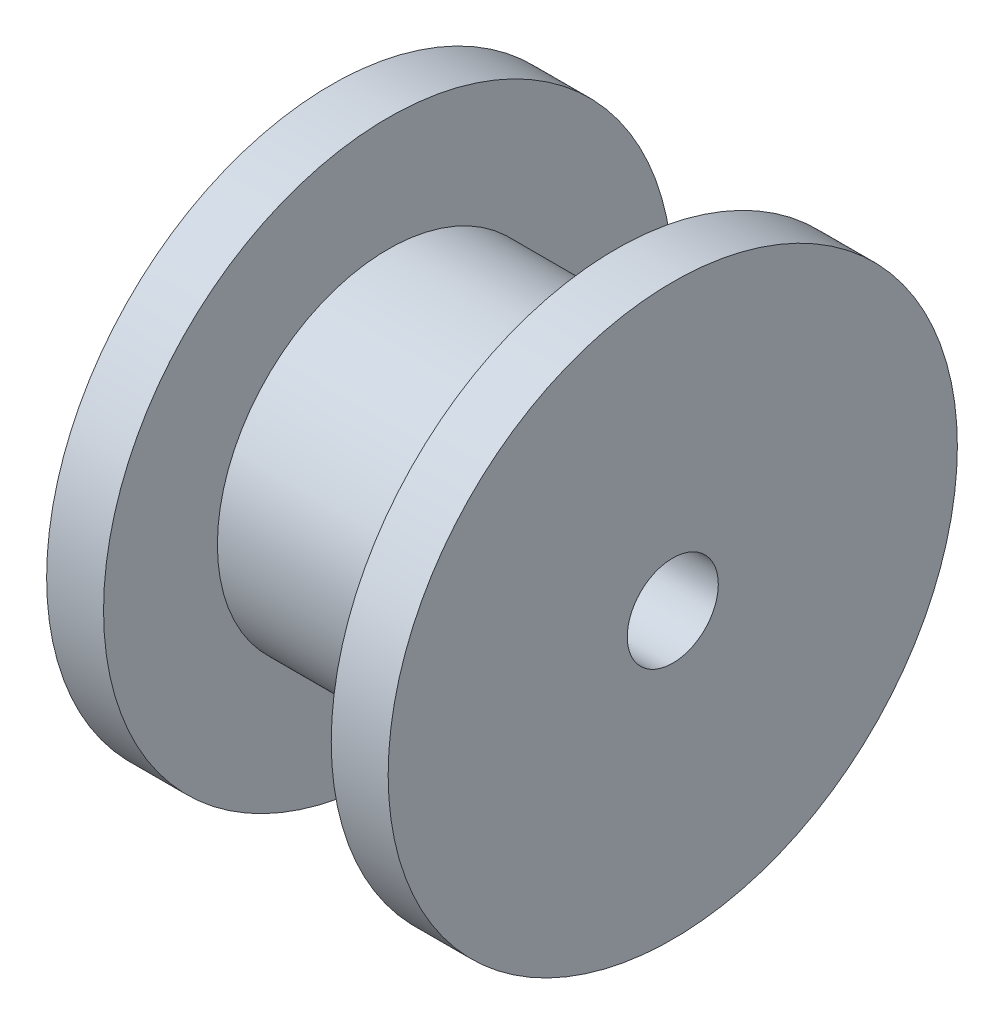
from build123d import *

# Parameters (mm, degrees)
SKETCH_1_R          = 10
EXTRUDE_1_DEPTH     = 2
SKETCH_2_R          = 6
EXTRUDE_2_DEPTH     = 8
SKETCH_3_R          = 10
EXTRUDE_3_DEPTH     = 2
SKETCH_6_R          = 1.6
CUT_EXTRUDE_3_DEPTH = 19.547236991


with BuildPart() as part:
    # Эскиз1 → Бобышка-Вытянуть1 (new body)
    with BuildSketch(Plane(origin=(0, 0, 0), x_dir=(0, 0, -1), z_dir=(1, 0, 0))):
        Circle(SKETCH_1_R)
    extrude(amount=EXTRUDE_1_DEPTH)

    # Эскиз2 → Бобышка-Вытянуть2 (add)
    with BuildSketch(Plane(origin=(2, 0, 0), x_dir=(0, 0, -1), z_dir=(1, 0, 0))):
        Circle(SKETCH_2_R)
    extrude(amount=EXTRUDE_2_DEPTH)

    # Эскиз3 → Бобышка-Вытянуть3 (add)
    with BuildSketch(Plane(origin=(10, 0, 0), x_dir=(0, 0, -1), z_dir=(1, 0, 0))):
        Circle(SKETCH_3_R)
    extrude(amount=EXTRUDE_3_DEPTH)

    # Эскиз6 → Вырез-Вытянуть3 (cut, through all)
    with BuildSketch(Plane(origin=(12, 0, 0), x_dir=(0, 0, -1), z_dir=(1, 0, 0))):
        Circle(SKETCH_6_R)
    extrude(amount=-CUT_EXTRUDE_3_DEPTH, mode=Mode.SUBTRACT)


solid = part.part
